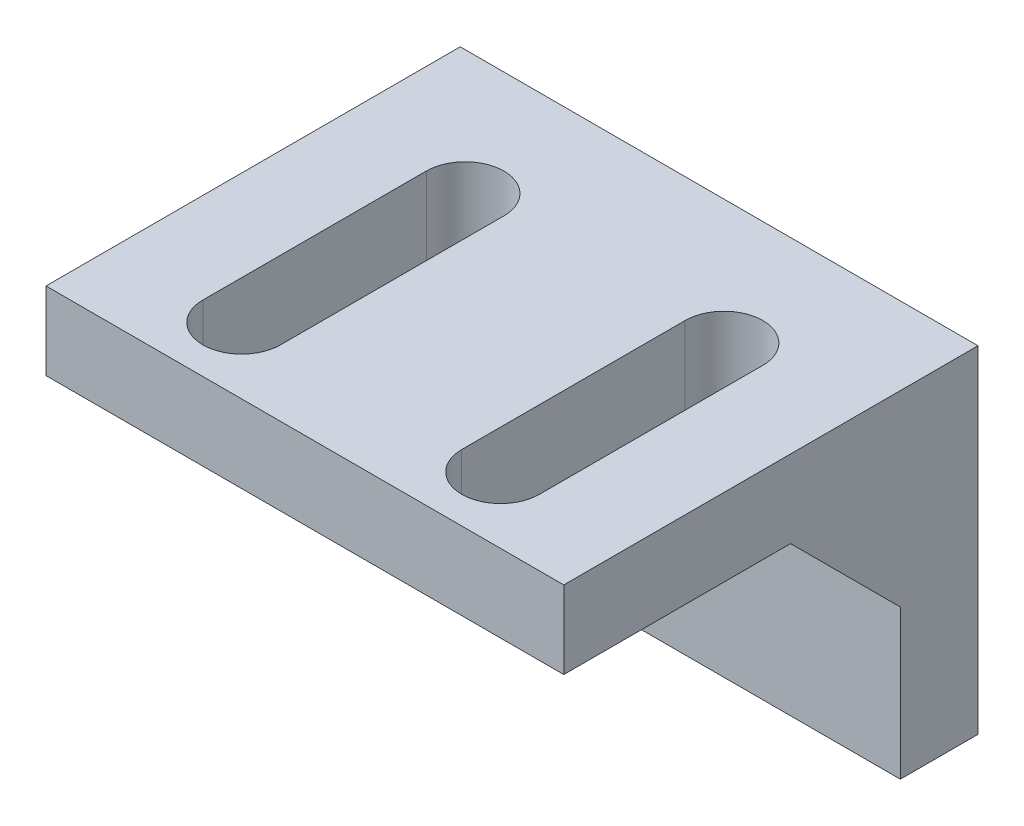
from build123d import *

# Parameters (mm, degrees)
SKETCH1_W           = 20
SKETCH1_H           = 13
BOSS_EXTRUDE1_DEPTH = 3
SKETCH2_W           = 20
SKETCH2_H           = 3
BOSS_EXTRUDE2_DEPTH = 13
BOSS_EXTRUDE3_DEPTH = 3
CUT_EXTRUDE1_DEPTH  = 40.66221139


with BuildPart() as part:
    # Sketch1 → Boss-Extrude1 (new body)
    with BuildSketch(Plane.XY):
        with Locations((24.886831503, -27.055)):
            Rectangle(SKETCH1_W, SKETCH1_H)
    extrude(amount=BOSS_EXTRUDE1_DEPTH)

    # Sketch2 → Boss-Extrude2 (add)
    with BuildSketch(Plane.XY.offset(3)):
        with Locations((24.886831503, -22.055)):
            Rectangle(SKETCH2_W, SKETCH2_H)
    extrude(amount=BOSS_EXTRUDE2_DEPTH)

    # Sketch3 → Boss-Extrude3 (add)
    with BuildSketch(Plane(origin=(34.886831503, 0, 0), x_dir=(0, 0, -1), z_dir=(1, 0, 0))):
        Polygon((-7.239132511, -23.555), (-3, -27.79413251), (-3, -23.554999999), align=None)
    boss_extrude3 = extrude(amount=-BOSS_EXTRUDE3_DEPTH)

    # Sketch4 → Cut-Extrude1 (cut, through all)
    with BuildSketch(Plane.XZ.offset(23.555)):
        with BuildLine():
            Line((28.386831503, 4.812110779), (28.386831503, 13.441160462))
            ThreePointArc((28.386831503, 13.441160462), (29.886831503, 14.941160462), (31.386831503, 13.441160462))
            Line((31.386831503, 13.441160462), (31.386831503, 4.812110779))
            ThreePointArc((31.386831503, 4.812110779), (29.886831503, 3.312110779), (28.386831503, 4.812110779))
        make_face()
    cut_extrude1 = extrude(amount=-CUT_EXTRUDE1_DEPTH, mode=Mode.SUBTRACT)

    # Mirror1: Boss-Extrude3, Cut-Extrude1 across plane
    add(boss_extrude3.mirror(Plane.ZY.offset(-24.886831503)))
    add(cut_extrude1.mirror(Plane.ZY.offset(-24.886831503)), mode=Mode.SUBTRACT)


solid = part.part
